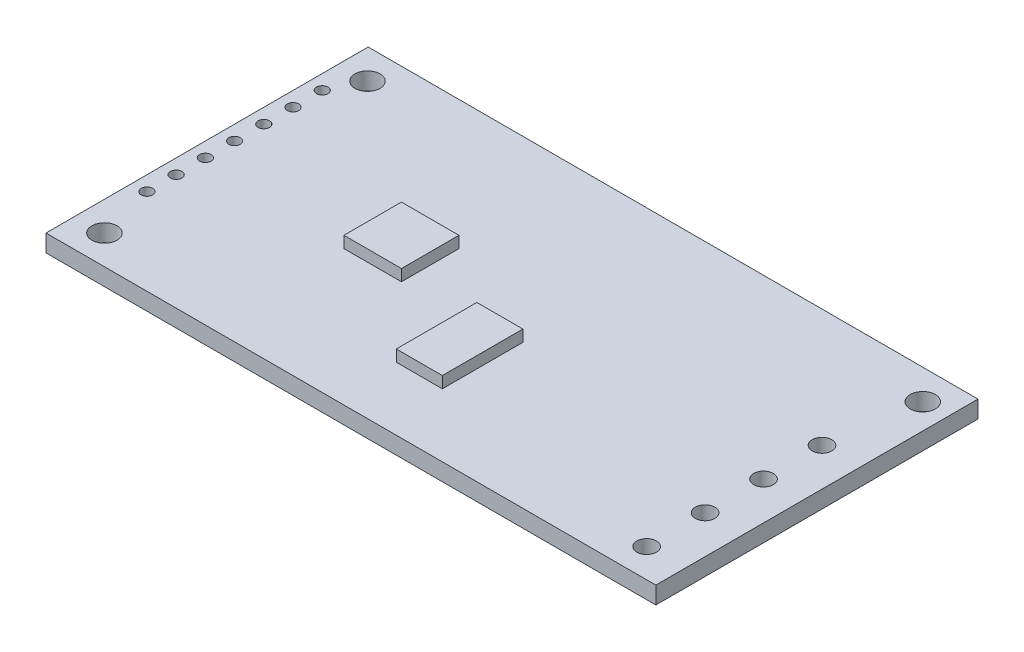
from build123d import *

# Parameters (mm, degrees)
SKETCH1_W            = 53
SKETCH1_H            = 28
BOSS_EXTRUDE1_DEPTH  = 1.5
SKETCH2_R            = 1.0922
CUT_EXTRUDE1_DEPTH   = 31.008332176
LPATTERN1_COUNT      = 2
LPATTERN1_PITCH      = 22.86
LPATTERN1_COUNT_DIR2 = 2
LPATTERN1_PITCH_DIR2 = 48.26
SKETCH3_R            = 0.5
CUT_EXTRUDE2_DEPTH   = 31.008332176
LPATTERN2_COUNT      = 7
LPATTERN2_PITCH      = 2.54
SKETCH5_R            = 0.85
CUT_EXTRUDE3_DEPTH   = 31.008332176
LPATTERN4_COUNT      = 4
LPATTERN4_PITCH      = 5.08
SKETCH6_W            = 5
SKETCH6_H            = 5
SKETCH6_W_2          = 4
SKETCH6_H_2          = 7
BOSS_EXTRUDE3_DEPTH  = 1


with BuildPart() as part:
    # Sketch1 → Boss-Extrude1 (new body)
    with BuildSketch(Plane(origin=(0, 0, 0), x_dir=(1, 0, 0), z_dir=(0, 1, 0))):
        Rectangle(SKETCH1_W, SKETCH1_H)
    extrude(amount=BOSS_EXTRUDE1_DEPTH)

    # Sketch2 → Cut-Extrude1 (cut, through all)
    with BuildSketch(Plane(origin=(0, 1.5, 0), x_dir=(1, 0, 0), z_dir=(0, 1, 0))):
        with Locations(Location((-23.96, -11.46, 0), (0, 0, 270))):
            Circle(SKETCH2_R)
    cut_extrude1 = extrude(amount=-CUT_EXTRUDE1_DEPTH, mode=Mode.SUBTRACT)

    # LPattern1: Cut-Extrude1 2 × 2, 1 skipped
    with Locations(*[(j * LPATTERN1_PITCH_DIR2, 0, -i * LPATTERN1_PITCH) for i in range(LPATTERN1_COUNT) for j in range(LPATTERN1_COUNT_DIR2) if (i, j) not in ((0, 0), (0, 1))]):
        add(cut_extrude1, mode=Mode.SUBTRACT)

    # Sketch3 → Cut-Extrude2 (cut, through all)
    with BuildSketch(Plane(origin=(0, 1.5, 0), x_dir=(1, 0, 0), z_dir=(0, 1, 0))):
        with Locations(Location((-25.23, 8.739816389, 0), (0, 0, 270))):
            Circle(SKETCH3_R)
    cut_extrude2 = extrude(amount=-CUT_EXTRUDE2_DEPTH, mode=Mode.SUBTRACT)

    # LPattern2: Cut-Extrude2 ×7
    with Locations(*[(0, 0, i * LPATTERN2_PITCH) for i in range(1, LPATTERN2_COUNT)]):
        add(cut_extrude2, mode=Mode.SUBTRACT)

    # Sketch5 → Cut-Extrude3 (cut, through all)
    with BuildSketch(Plane(origin=(0, 1.5, 0), x_dir=(1, 0, 0), z_dir=(0, 1, 0))):
        with Locations(Location((23.2, -11.5, 0), (0, 0, 270))):
            Circle(SKETCH5_R)
    cut_extrude3 = extrude(amount=-CUT_EXTRUDE3_DEPTH, mode=Mode.SUBTRACT)

    # LPattern4: Cut-Extrude3 ×4
    with Locations(*[(0, 0, -i * LPATTERN4_PITCH) for i in range(1, LPATTERN4_COUNT)]):
        add(cut_extrude3, mode=Mode.SUBTRACT)

    # Sketch6 → Boss-Extrude3 (add)
    with BuildSketch(Plane(origin=(0, 1.5, 0), x_dir=(1, 0, 0), z_dir=(0, 1, 0))):
        with Locations((-9.881626536, 0.272798855)):
            Rectangle(SKETCH6_W, SKETCH6_H)
        with Locations((0.450562485, -5.004455937)):
            Rectangle(SKETCH6_W_2, SKETCH6_H_2)
    extrude(amount=BOSS_EXTRUDE3_DEPTH)


solid = part.part
